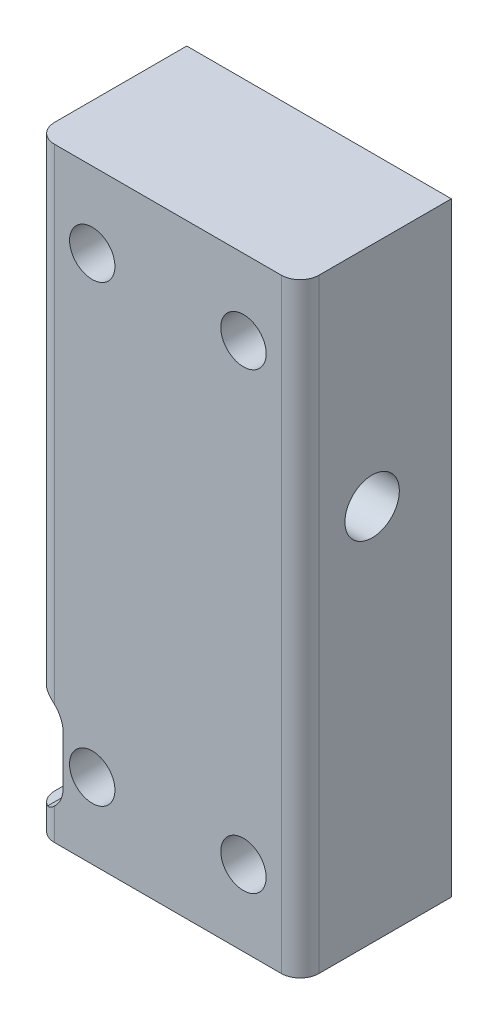
from build123d import *

# Parameters (mm, degrees)
SKETCH1_W           = 22.225
SKETCH1_H           = 12.7
BOSS_EXTRUDE1_DEPTH = 50.8
SKETCH2_R           = 1.905
CUT_EXTRUDE1_DEPTH  = 57.884801353
CUT_EXTRUDE2_DEPTH  = 56.811406764
FILLET1_R           = 1.5875
SKETCH6_R           = 2.286
CUT_EXTRUDE3_DEPTH  = 57.884801482


with BuildPart() as part:
    # Sketch1 → Boss-Extrude1 (new body)
    with BuildSketch(Plane(origin=(0, 0, 0), x_dir=(1, 0, 0), z_dir=(0, 1, 0))):
        with Locations((11.1125, 6.35)):
            Rectangle(SKETCH1_W, SKETCH1_H)
    extrude(amount=BOSS_EXTRUDE1_DEPTH)

    # Sketch2 → Cut-Extrude1 (cut, through all)
    with BuildSketch(Plane(origin=(0, 0, -12.7), x_dir=(-1, 0, 0), z_dir=(0, 0, -1))):
        with Locations((-17.4625, 44.45)):
            Circle(SKETCH2_R)
        with Locations((-17.4625, 6.35)):
            Circle(SKETCH2_R)
        with Locations((-4.7625, 44.45)):
            Circle(SKETCH2_R)
        with Locations((-4.7625, 6.35)):
            Circle(SKETCH2_R)
    extrude(amount=-CUT_EXTRUDE1_DEPTH, mode=Mode.SUBTRACT)

    # Sketch3 → Cut-Extrude2 (cut, through all)
    with BuildSketch(Plane(origin=(0, 0, -6.35), x_dir=(-1, 0, 0), z_dir=(0, 0, -1))):
        with BuildLine():
            Line((0, 10.541), (0, 2.159))
            Line((0, 2.159), (-0.79375, 2.159))
            ThreePointArc((-0.79375, 2.159), (-1.786060968, 2.860879553), (-2.286, 3.96875))
            Line((-2.286, 3.96875), (-2.286, 8.73125))
            ThreePointArc((-2.286, 8.73125), (-1.786060968, 9.839120447), (-0.79375, 10.541))
            Line((-0.79375, 10.541), (0, 10.541))
        make_face()
    extrude(amount=-CUT_EXTRUDE2_DEPTH, mode=Mode.SUBTRACT)

    # Sketch5 → Cut-Revolve2 (revolve, cut)
    with BuildSketch(Plane(origin=(0, 0, -6.35), x_dir=(-1, 0, 0), z_dir=(0, 0, -1))):
        with BuildLine():
            Line((0, 6.35), (-2.286, 6.35))
            Line((-2.286, 6.35), (-2.286, 8.73125))
            ThreePointArc((-2.286, 8.73125), (-1.786060968, 9.839120447), (-0.79375, 10.541))
            Line((-0.79375, 10.541), (0, 10.541))
            Line((0, 10.541), (0, 6.35))
        make_face()
    revolve(axis=Axis((2.286, 6.35, -6.35), (-1, 0, 0)), mode=Mode.SUBTRACT)

    # Fillet1
    fillet1_edges = [part.edges().sort_by_distance(p)[0] for p in [
        (0, 30.6705, 0),
        (0, 1.0795, 0),
        (22.225, 25.4, 0),
    ]]
    fillet(fillet1_edges, radius=FILLET1_R)

    # Sketch6 → Cut-Extrude3 (cut, through all)
    with BuildSketch(Plane(origin=(22.225, 0, 0), x_dir=(0, 0, -1), z_dir=(1, 0, 0))):
        with Locations((6.045199993, 31.75)):
            Circle(SKETCH6_R)
    extrude(amount=-CUT_EXTRUDE3_DEPTH, mode=Mode.SUBTRACT)


solid = part.part
